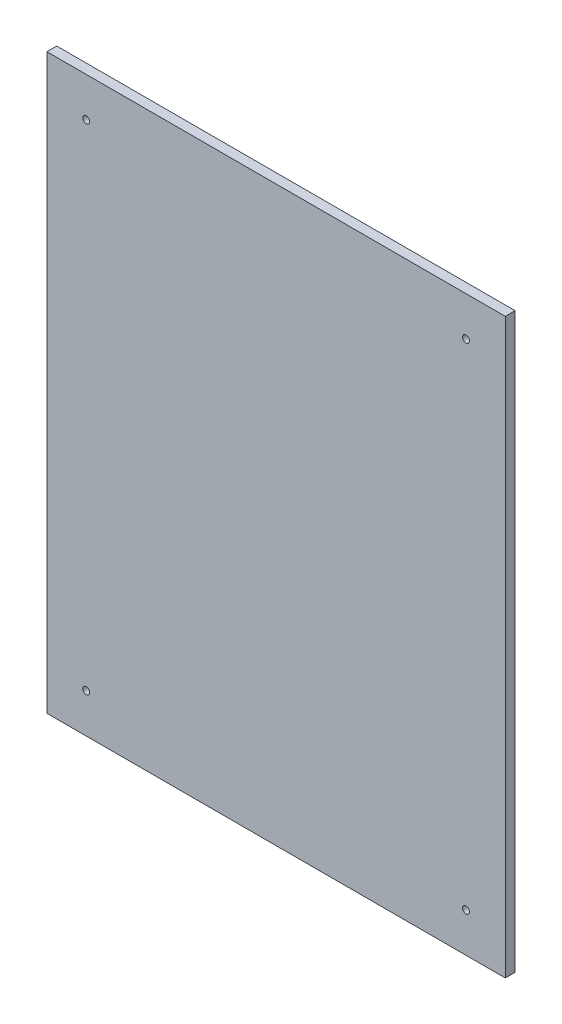
from build123d import *

# Parameters (mm, degrees)
ESBO_O1_W                    = 280
ESBO_O1_H                    = 350
RESSALTO_EXTRUS_O1_DEPTH     = 6
FURO_DE_DI_METRO_4_2_4_2_1_D = 4.2


with BuildPart() as part:
    # Esboço1 → Ressalto-extrusão1 (new body)
    with BuildSketch(Plane.XY.offset(5)):
        Rectangle(ESBO_O1_W, ESBO_O1_H)
    extrude(amount=-RESSALTO_EXTRUS_O1_DEPTH)

    # Furo de diâmetro Ø4.2 (4.2)1 (through all)
    with Locations(Plane(origin=(0, 0, -1), x_dir=(-1, 0, 0), z_dir=(0, 0, -1))):
        with Locations((-116, 151), (-116, -151), (116, -151), (116, 151)):
            Hole(FURO_DE_DI_METRO_4_2_4_2_1_D / 2)


solid = part.part
